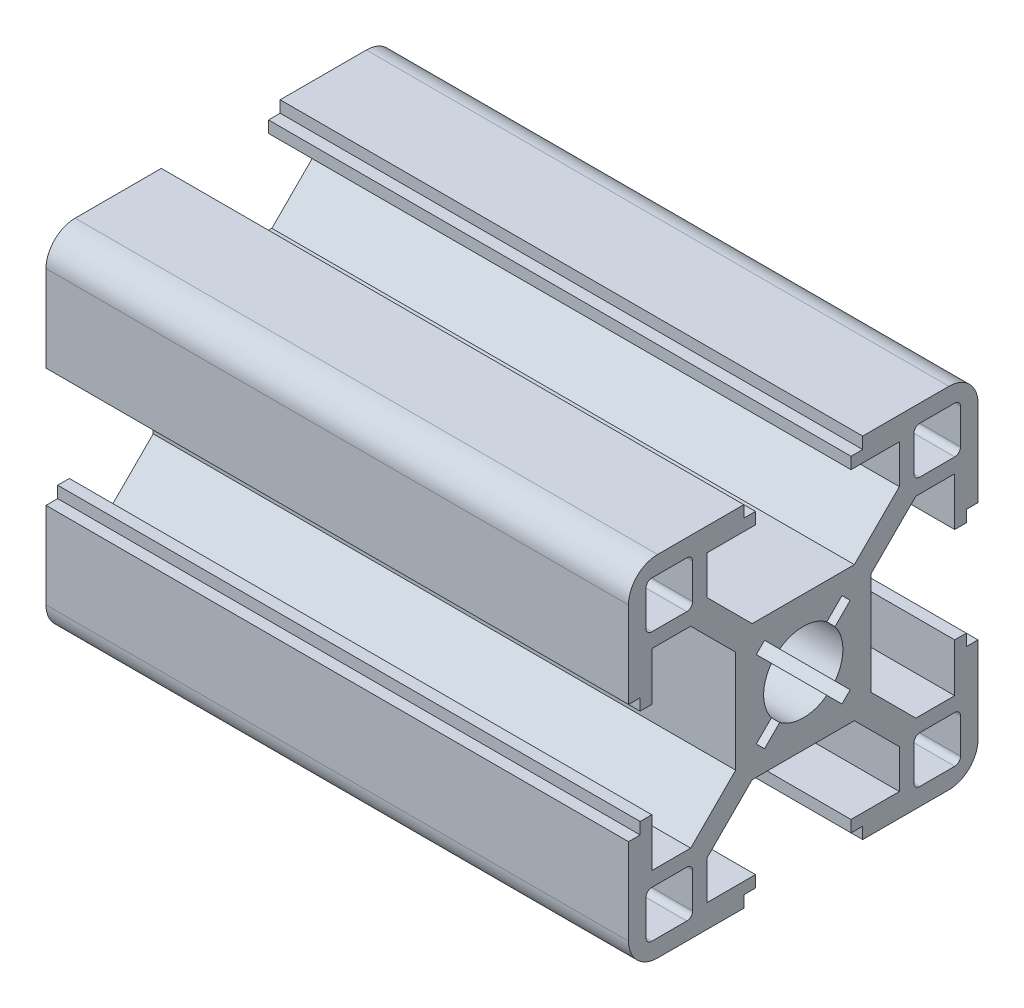
from build123d import *

# Parameters (mm, degrees)
EXTRUDE_1_DEPTH = 50


with BuildPart() as part:
    # 草图1 → 凸台-拉伸1 (new body)
    with BuildSketch(Plane(origin=(0, 0, 0), x_dir=(0, 0, -1), z_dir=(1, 0, 0))):
        with BuildLine():
            Line((-5.14957074, -13.70467014), (-4.14957074, -13.70467014))
            Line((-4.14957074, -13.70467014), (-4.14957074, -12.70467014))
            Line((-4.14957074, -12.70467014), (-8.29957074, -12.70467014))
            Line((-8.29957074, -12.70467014), (-8.29957074, -9.3688837))
            Line((-8.29957074, -9.3688837), (-4.43535718, -5.50467014))
            Line((-4.43535718, -5.50467014), (4.3362157, -5.50467014))
            Line((4.3362157, -5.50467014), (8.20042926, -9.3688837))
            Line((8.20042926, -9.3688837), (8.20042926, -12.70467014))
            Line((8.20042926, -12.70467014), (4.05042926, -12.70467014))
            Line((4.05042926, -12.70467014), (4.05042926, -13.70467014))
            Line((4.05042926, -13.70467014), (5.05042926, -13.70467014))
            Line((5.05042926, -13.70467014), (5.05042926, -14.70467014))
            Line((5.05042926, -14.70467014), (12.45042926, -14.70467014))
            ThreePointArc((12.45042926, -14.70467014), (14.218196213, -13.972437093), (14.95042926, -12.20467014))
            Line((14.95042926, -12.20467014), (14.95042926, -4.80467014))
            Line((14.95042926, -4.80467014), (13.95042926, -4.80467014))
            Line((13.95042926, -4.80467014), (13.95042926, -3.80467014))
            Line((13.95042926, -3.80467014), (12.95042926, -3.80467014))
            Line((12.95042926, -3.80467014), (12.95042926, -7.95467014))
            Line((12.95042926, -7.95467014), (9.61464282, -7.95467014))
            Line((9.61464282, -7.95467014), (5.75042926, -4.09045658))
            Line((5.75042926, -4.09045658), (5.75042926, 4.6811163))
            Line((5.75042926, 4.6811163), (9.61464282, 8.54532986))
            Line((9.61464282, 8.54532986), (12.95042926, 8.54532986))
            Line((12.95042926, 8.54532986), (12.95042926, 4.39532986))
            Line((12.95042926, 4.39532986), (13.95042926, 4.39532986))
            Line((13.95042926, 4.39532986), (13.95042926, 5.39532986))
            Line((13.95042926, 5.39532986), (14.95042926, 5.39532986))
            Line((14.95042926, 5.39532986), (14.95042926, 12.79532986))
            ThreePointArc((14.95042926, 12.79532986), (14.218196213, 14.563096813), (12.45042926, 15.29532986))
            Line((12.45042926, 15.29532986), (5.05042926, 15.29532986))
            Line((5.05042926, 15.29532986), (5.05042926, 14.29532986))
            Line((5.05042926, 14.29532986), (4.05042926, 14.29532986))
            Line((4.05042926, 14.29532986), (4.05042926, 13.29532986))
            Line((4.05042926, 13.29532986), (8.20042926, 13.29532986))
            Line((8.20042926, 13.29532986), (8.20042926, 9.95954342))
            Line((8.20042926, 9.95954342), (4.3362157, 6.09532986))
            Line((4.3362157, 6.09532986), (-4.43535718, 6.09532986))
            Line((-4.43535718, 6.09532986), (-8.29957074, 9.95954342))
            Line((-8.29957074, 9.95954342), (-8.29957074, 13.29532986))
            Line((-8.29957074, 13.29532986), (-4.14957074, 13.29532986))
            Line((-4.14957074, 13.29532986), (-4.14957074, 14.29532986))
            Line((-4.14957074, 14.29532986), (-5.14957074, 14.29532986))
            Line((-5.14957074, 14.29532986), (-5.14957074, 15.29532986))
            Line((-5.14957074, 15.29532986), (-12.54957074, 15.29532986))
            ThreePointArc((-12.54957074, 15.29532986), (-14.317337693, 14.563096813), (-15.04957074, 12.79532986))
            Line((-15.04957074, 12.79532986), (-15.04957074, 5.39532986))
            Line((-15.04957074, 5.39532986), (-14.04957074, 5.39532986))
            Line((-14.04957074, 5.39532986), (-14.04957074, 4.39532986))
            Line((-14.04957074, 4.39532986), (-13.04957074, 4.39532986))
            Line((-13.04957074, 4.39532986), (-13.04957074, 8.54532986))
            Line((-13.04957074, 8.54532986), (-9.7137843, 8.54532986))
            Line((-9.7137843, 8.54532986), (-5.84957074, 4.6811163))
            Line((-5.84957074, 4.6811163), (-5.84957074, -4.09045658))
            Line((-5.84957074, -4.09045658), (-9.7137843, -7.95467014))
            Line((-9.7137843, -7.95467014), (-13.04957074, -7.95467014))
            Line((-13.04957074, -7.95467014), (-13.04957074, -3.80467014))
            Line((-13.04957074, -3.80467014), (-14.04957074, -3.80467014))
            Line((-14.04957074, -3.80467014), (-14.04957074, -4.80467014))
            Line((-14.04957074, -4.80467014), (-15.04957074, -4.80467014))
            Line((-15.04957074, -4.80467014), (-15.04957074, -12.20467014))
            ThreePointArc((-15.04957074, -12.20467014), (-14.317337693, -13.972437093), (-12.54957074, -14.70467014))
            Line((-12.54957074, -14.70467014), (-5.14957074, -14.70467014))
            Line((-5.14957074, -14.70467014), (-5.14957074, -13.70467014))
        make_face()
        with BuildLine():
            Line((-10.04957074, 9.79532986), (-13.04957074, 9.79532986))
            ThreePointArc((-13.04957074, 9.79532986), (-13.403124131, 9.941776469), (-13.54957074, 10.29532986))
            Line((-13.54957074, 10.29532986), (-13.54957074, 13.29532986))
            ThreePointArc((-13.54957074, 13.29532986), (-13.403124131, 13.648883251), (-13.04957074, 13.79532986))
            Line((-13.04957074, 13.79532986), (-10.04957074, 13.79532986))
            ThreePointArc((-10.04957074, 13.79532986), (-9.696017349, 13.648883251), (-9.54957074, 13.29532986))
            Line((-9.54957074, 13.29532986), (-9.54957074, 10.29532986))
            ThreePointArc((-9.54957074, 10.29532986), (-9.696017349, 9.941776469), (-10.04957074, 9.79532986))
        make_face(mode=Mode.SUBTRACT)
        with BuildLine():
            Line((-10.04957074, -13.20467014), (-13.04957074, -13.20467014))
            ThreePointArc((-13.04957074, -13.20467014), (-13.403124131, -13.058223531), (-13.54957074, -12.70467014))
            Line((-13.54957074, -12.70467014), (-13.54957074, -9.70467014))
            ThreePointArc((-13.54957074, -9.70467014), (-13.403124131, -9.351116749), (-13.04957074, -9.20467014))
            Line((-13.04957074, -9.20467014), (-10.04957074, -9.20467014))
            ThreePointArc((-10.04957074, -9.20467014), (-9.696017349, -9.351116749), (-9.54957074, -9.70467014))
            Line((-9.54957074, -9.70467014), (-9.54957074, -12.70467014))
            ThreePointArc((-9.54957074, -12.70467014), (-9.696017349, -13.058223531), (-10.04957074, -13.20467014))
        make_face(mode=Mode.SUBTRACT)
        with BuildLine():
            Line((12.95042926, 9.79532986), (9.95042926, 9.79532986))
            ThreePointArc((9.95042926, 9.79532986), (9.596875869, 9.941776469), (9.45042926, 10.29532986))
            Line((9.45042926, 10.29532986), (9.45042926, 13.29532986))
            ThreePointArc((9.45042926, 13.29532986), (9.596875869, 13.648883251), (9.95042926, 13.79532986))
            Line((9.95042926, 13.79532986), (12.95042926, 13.79532986))
            ThreePointArc((12.95042926, 13.79532986), (13.303982651, 13.648883251), (13.45042926, 13.29532986))
            Line((13.45042926, 13.29532986), (13.45042926, 10.29532986))
            ThreePointArc((13.45042926, 10.29532986), (13.303982651, 9.941776469), (12.95042926, 9.79532986))
        make_face(mode=Mode.SUBTRACT)
        with BuildLine():
            Line((13.45042926, -9.70467014), (13.45042926, -12.70467014))
            ThreePointArc((13.45042926, -12.70467014), (13.303982651, -13.058223531), (12.95042926, -13.20467014))
            Line((12.95042926, -13.20467014), (9.95042926, -13.20467014))
            ThreePointArc((9.95042926, -13.20467014), (9.596875869, -13.058223531), (9.45042926, -12.70467014))
            Line((9.45042926, -12.70467014), (9.45042926, -9.70467014))
            ThreePointArc((9.45042926, -9.70467014), (9.596875869, -9.351116749), (9.95042926, -9.20467014))
            Line((9.95042926, -9.20467014), (12.95042926, -9.20467014))
            ThreePointArc((12.95042926, -9.20467014), (13.303982651, -9.351116749), (13.45042926, -9.70467014))
        make_face(mode=Mode.SUBTRACT)
        with BuildLine():
            Line((-4.07998961, 3.61864195), (-3.37288283, 4.32574873))
            Line((-3.37288283, 4.32574873), (-2.07404174, 3.02690764))
            ThreePointArc((-2.07404174, 3.02690764), (-0.04957074, 3.69532986), (1.97490026, 3.02690764))
            Line((1.97490026, 3.02690764), (3.27374135, 4.32574873))
            Line((3.27374135, 4.32574873), (3.98084813, 3.61864195))
            Line((3.98084813, 3.61864195), (2.68200704, 2.31980086))
            ThreePointArc((2.68200704, 2.31980086), (3.35042926, 0.29532986), (2.68200704, -1.72914114))
            Line((2.68200704, -1.72914114), (3.98084813, -3.02798223))
            Line((3.98084813, -3.02798223), (3.27374135, -3.73508901))
            Line((3.27374135, -3.73508901), (1.97490026, -2.43624792))
            ThreePointArc((1.97490026, -2.43624792), (-0.04957074, -3.10467014), (-2.07404174, -2.43624792))
            Line((-2.07404174, -2.43624792), (-3.37288283, -3.73508901))
            Line((-3.37288283, -3.73508901), (-4.07998961, -3.02798223))
            Line((-4.07998961, -3.02798223), (-2.78114852, -1.72914114))
            ThreePointArc((-2.78114852, -1.72914114), (-3.44957074, 0.29532986), (-2.78114852, 2.31980086))
            Line((-2.78114852, 2.31980086), (-4.07998961, 3.61864195))
        make_face(mode=Mode.SUBTRACT)
    extrude(amount=-EXTRUDE_1_DEPTH)


solid = part.part
